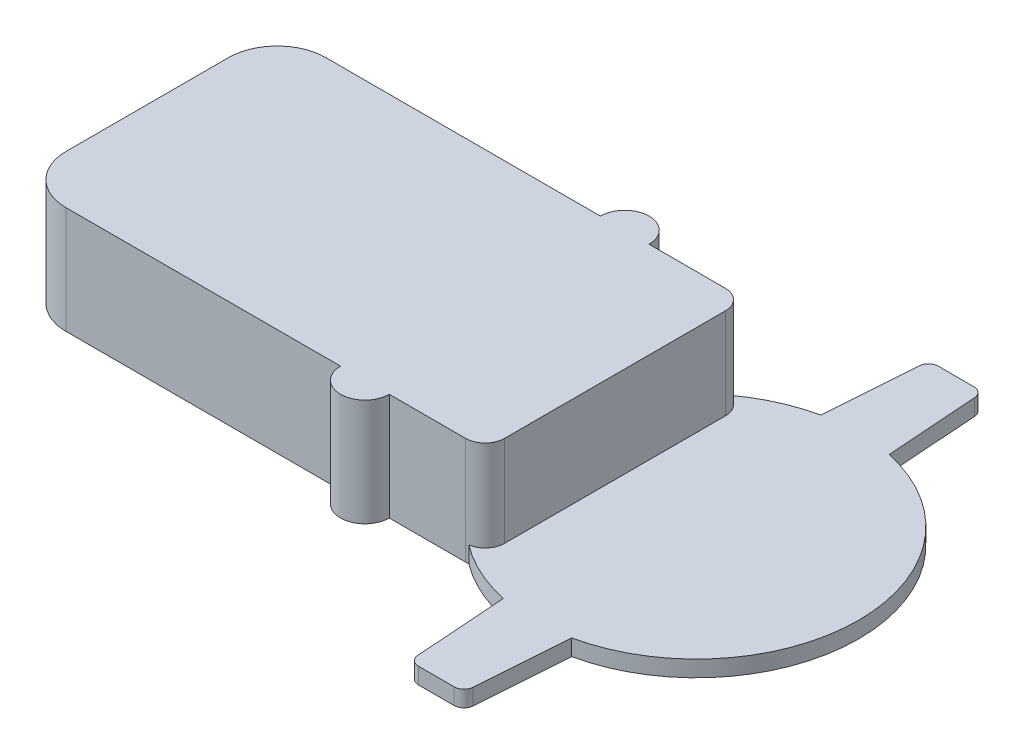
from build123d import *

# Parameters (mm, degrees)
BOSS_EXTRUDE1_DEPTH = 5
BOSS_EXTRUDE2_DEPTH = 33


with BuildPart() as part:
    # Sketch1 → Boss-Extrude1 (new body)
    with BuildSketch(Plane(origin=(0, 0, 0), x_dir=(1, 0, 0), z_dir=(0, 1, 0))):
        with BuildLine():
            Line((-10.5, 48.885069295), (-8.5, 77.211291854))
            ThreePointArc((-8.5, 77.211291854), (-7.552703541, 79.194752328), (-5.507449958, 80))
            Line((-5.507449958, 80), (5.507449958, 80))
            ThreePointArc((5.507449958, 80), (7.552703541, 79.194752328), (8.5, 77.211291854))
            Line((8.5, 77.211291854), (10.5, 48.885069295))
            ThreePointArc((10.5, 48.885069295), (50, 0), (10.5, -48.885069295))
            Line((10.5, -48.885069295), (8.5, -77.211291854))
            ThreePointArc((8.5, -77.211291854), (7.552703541, -79.194752328), (5.507449958, -80))
            Line((5.507449958, -80), (-5.507449958, -80))
            ThreePointArc((-5.507449958, -80), (-7.552703541, -79.194752328), (-8.5, -77.211291854))
            Line((-8.5, -77.211291854), (-10.5, -48.885069295))
            ThreePointArc((-10.5, -48.885069295), (-50, 0), (-10.5, 48.885069295))
        make_face()
    extrude(amount=BOSS_EXTRUDE1_DEPTH)

    # Sketch2 → Boss-Extrude2 (add)
    with BuildSketch(Plane(origin=(0, 0, 0), x_dir=(1, 0, 0), z_dir=(0, 1, 0))):
        with BuildLine():
            Line((-154, -40), (-69.5, -40))
            ThreePointArc((-69.5, -40), (-62, -47.5), (-54.5, -40))
            Line((-54.5, -40), (-31, -40))
            ThreePointArc((-31, -40), (-26.757359313, -38.242640687), (-25, -34))
            Line((-25, -34), (-25, 34))
            ThreePointArc((-25, 34), (-26.757359313, 38.242640687), (-31, 40))
            Line((-31, 40), (-54.5, 40))
            ThreePointArc((-54.5, 40), (-62, 47.5), (-69.5, 40))
            Line((-69.5, 40), (-154, 40))
            ThreePointArc((-154, 40), (-164.606601718, 35.606601718), (-169, 25))
            Line((-169, 25), (-169, -25))
            ThreePointArc((-169, -25), (-164.606601718, -35.606601718), (-154, -40))
        make_face()
    extrude(amount=BOSS_EXTRUDE2_DEPTH)


solid = part.part
